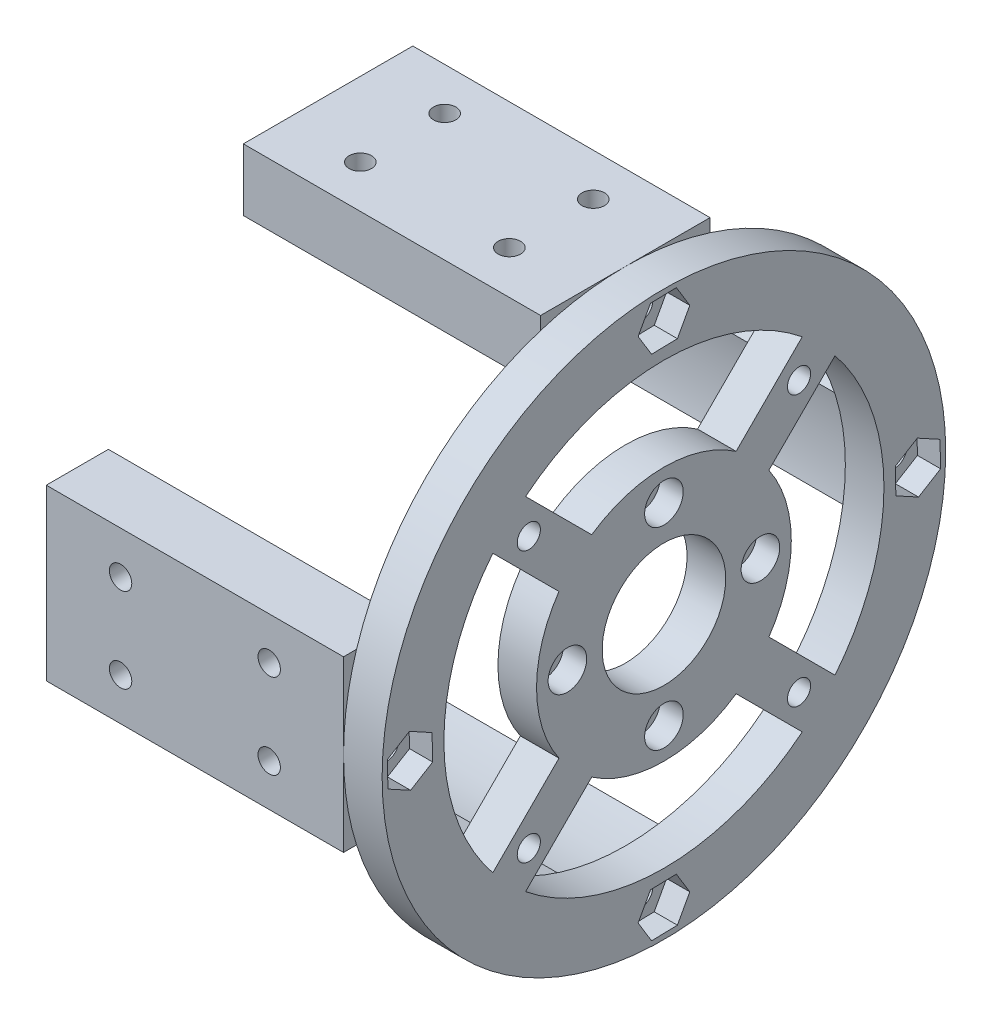
from build123d import *

# Parameters (mm, degrees)
SKETCH_1_R               = 36.5
SKETCH_1_R_2             = 1.55
SKETCH_1_R_3             = 8
EXTRUDE_1_DEPTH          = 5
CUT_EXTRUDE_2_REACH      = 53.86
SKETCH_5_R               = 1.55
CUT_EXTRUDE_3_REACH      = 53.86
SKETCH_7_R               = 1.55
CUT_EXTRUDE_4_DEPTH      = 3
SKETCH_9_R               = 1.55
EXTRUDE_4_DEPTH          = 38.5
SKETCH_10_R              = 1.5
CUT_EXTRUDE_5_DEPTH      = 5
PATTERN_CIRCULAR_1_COUNT = 4
SKETCH_16_R              = 1.45
CUT_EXTRUDE_6_DEPTH      = 3
SKETCH_17_R              = 1.45
CUT_EXTRUDE_7_DEPTH      = 3
SKETCH_18_R              = 2.5
CUT_EXTRUDE_8_DEPTH      = 3


with BuildPart() as part:
    # 草图1 → 凸台-拉伸1 (new body)
    with BuildSketch(Plane(origin=(0, 0, 0), x_dir=(0, 0, -1), z_dir=(1, 0, 0))):
        Circle(SKETCH_1_R)
        with Locations((0, 12.5)):
            Circle(SKETCH_1_R_2, mode=Mode.SUBTRACT)
        with Locations((12.5, 0)):
            Circle(SKETCH_1_R_2, mode=Mode.SUBTRACT)
        with Locations((0, -12.5)):
            Circle(SKETCH_1_R_2, mode=Mode.SUBTRACT)
        with Locations((-12.5, 0)):
            Circle(SKETCH_1_R_2, mode=Mode.SUBTRACT)
        Circle(SKETCH_1_R_3, mode=Mode.SUBTRACT)
        with BuildLine():
            Line((13.594114249, 9.351473562), (22.161904167, 17.91926348))
            ThreePointArc((22.161904167, 17.91926348), (28.5, 0), (22.161904167, -17.91926348))
            Line((22.161904167, -17.91926348), (13.594114249, -9.351473562))
            ThreePointArc((13.594114249, -9.351473562), (16.5, 0), (13.594114249, 9.351473562))
        make_face(mode=Mode.SUBTRACT)
        with BuildLine():
            Line((9.351473562, 13.594114249), (17.91926348, 22.161904167))
            ThreePointArc((17.91926348, 22.161904167), (0, 28.5), (-17.91926348, 22.161904167))
            Line((-17.91926348, 22.161904167), (-9.351473562, 13.594114249))
            ThreePointArc((-9.351473562, 13.594114249), (0, 16.5), (9.351473562, 13.594114249))
        make_face(mode=Mode.SUBTRACT)
        with BuildLine():
            Line((9.351473562, -13.594114249), (17.91926348, -22.161904167))
            ThreePointArc((17.91926348, -22.161904167), (0, -28.5), (-17.91926348, -22.161904167))
            Line((-17.91926348, -22.161904167), (-9.351473562, -13.594114249))
            ThreePointArc((-9.351473562, -13.594114249), (0, -16.5), (9.351473562, -13.594114249))
        make_face(mode=Mode.SUBTRACT)
        with BuildLine():
            Line((-13.594114249, -9.351473562), (-22.161904167, -17.91926348))
            ThreePointArc((-22.161904167, -17.91926348), (-28.5, 0), (-22.161904167, 17.91926348))
            Line((-22.161904167, 17.91926348), (-13.594114249, 9.351473562))
            ThreePointArc((-13.594114249, 9.351473562), (-16.5, 0), (-13.594114249, -9.351473562))
        make_face(mode=Mode.SUBTRACT)
    extrude(amount=-EXTRUDE_1_DEPTH)

    # 草图5 → 切除-拉伸2 (cut, up to next)
    with BuildSketch(Plane(origin=(0, 0, 0), x_dir=(0, 0, -1), z_dir=(1, 0, 0)), mode=Mode.PRIVATE) as cut_extrude_2_sk1:
        with Locations((-0.006483679, -32.906479867)):
            Circle(SKETCH_5_R)
    cut_extrude_2_tool1 = extrude(cut_extrude_2_sk1.sketch, amount=-CUT_EXTRUDE_2_REACH, mode=Mode.PRIVATE) & part.part
    # 草图5 → 切除-拉伸2 (cut, up to next)
    with BuildSketch(Plane(origin=(0, 0, 0), x_dir=(0, 0, -1), z_dir=(1, 0, 0)), mode=Mode.PRIVATE) as cut_extrude_2_sk2:
        with Locations((-32.9, 0)):
            Circle(SKETCH_5_R)
    cut_extrude_2_tool2 = extrude(cut_extrude_2_sk2.sketch, amount=-CUT_EXTRUDE_2_REACH, mode=Mode.PRIVATE) & part.part
    # 草图5 → 切除-拉伸2 (cut, up to next)
    with BuildSketch(Plane(origin=(0, 0, 0), x_dir=(0, 0, -1), z_dir=(1, 0, 0)), mode=Mode.PRIVATE) as cut_extrude_2_sk3:
        with Locations((0.006479867, 32.893516321)):
            Circle(SKETCH_5_R)
    cut_extrude_2_tool3 = extrude(cut_extrude_2_sk3.sketch, amount=-CUT_EXTRUDE_2_REACH, mode=Mode.PRIVATE) & part.part
    # 草图5 → 切除-拉伸2 (cut, up to next)
    with BuildSketch(Plane(origin=(0, 0, 0), x_dir=(0, 0, -1), z_dir=(1, 0, 0)), mode=Mode.PRIVATE) as cut_extrude_2_sk4:
        with Locations((32.899996188, -0.012963547)):
            Circle(SKETCH_5_R)
    cut_extrude_2_tool4 = extrude(cut_extrude_2_sk4.sketch, amount=-CUT_EXTRUDE_2_REACH, mode=Mode.PRIVATE) & part.part
    add(cut_extrude_2_tool1.solids().sort_by_distance((0, -32.90648, 0.006484))[0], mode=Mode.SUBTRACT)
    add(cut_extrude_2_tool2.solids().sort_by_distance((0, 0, 32.9))[0], mode=Mode.SUBTRACT)
    add(cut_extrude_2_tool3.solids().sort_by_distance((0, 32.893516, -0.00648))[0], mode=Mode.SUBTRACT)
    add(cut_extrude_2_tool4.solids().sort_by_distance((0, -0.012964, -32.899996))[0], mode=Mode.SUBTRACT)

    # 草图7 → 切除-拉伸3 (cut, up to next)
    with BuildSketch(Plane(origin=(0, 0, 0), x_dir=(0, 0, -1), z_dir=(1, 0, 0)), mode=Mode.PRIVATE) as cut_extrude_3_sk1:
        with Locations((9.1971e-05, -32.90647921)):
            Circle(SKETCH_7_R)
    cut_extrude_3_tool1 = extrude(cut_extrude_3_sk1.sketch, amount=-CUT_EXTRUDE_3_REACH, mode=Mode.PRIVATE) & part.part
    add(cut_extrude_3_tool1.solids().sort_by_distance((0, -32.906479, -9.2e-05))[0], mode=Mode.SUBTRACT)

    # 草图8 → 切除-拉伸4 (cut)
    with BuildSketch(Plane(origin=(0, 0, 0), x_dir=(0, 0, -1), z_dir=(1, 0, 0))):
        Polygon((35.836823617, -1.606256173), (35.757341789, 1.738938409), (32.820577385, 3.342702418), (29.963294811, 1.601271844), (30.042776639, -1.743922738), (32.979541042, -3.347686747), align=None)
        Polygon((3.35167445, 32.972998149), (1.610243876, 35.830280724), (-1.734950706, 35.750798895), (-3.338714715, 32.814034492), (-1.597284141, 29.956751917), (1.747910441, 30.036233746), align=None)
        Polygon((-1.59971328, -35.832835914), (1.745481303, -35.753354086), (3.349245312, -32.816589682), (1.607814738, -29.959307107), (-1.737379845, -30.038788936), (-3.341143854, -32.975553339), align=None)
        Polygon((-35.826293021, 1.603700983), (-35.746811192, -1.7414936), (-32.810046789, -3.345257608), (-29.952764214, -1.603827035), (-30.032246042, 1.741367548), (-32.969010446, 3.345131557), align=None)
    extrude(amount=-CUT_EXTRUDE_4_DEPTH, mode=Mode.SUBTRACT)

    # 草图9 → 凸台-拉伸4 (add)
    # profile 1 of 4: a face of its own
    with BuildSketch(Plane.ZY.offset(5)):
        with BuildLine():
            Line((-10.975761682, 36.5), (-10.975761682, 28.456680332))
            ThreePointArc((-10.975761682, 28.456680332), (-5.582170272, 29.984819077), (0, 30.5))
            Line((0, 30.5), (0, 30.518609682))
            ThreePointArc((0, 30.518609682), (4.640042689, 30.151557641), (9.171526885, 29.088366998))
            ThreePointArc((9.171526885, 29.088366998), (10.078594454, 28.78666243), (10.975761682, 28.456680332))
            Line((10.975761682, 28.456680332), (10.975761682, 36.5))
            Line((10.975761682, 36.5), (-10.975761682, 36.5))
        make_face()
        with Locations(Location((-0.006479867, 32.893516321, 0), (0, 0, 180))):
            Circle(SKETCH_9_R, mode=Mode.SUBTRACT)
    # profile 2 of 4: a face of its own
    with BuildSketch(Plane.ZY.offset(5)):
        with BuildLine():
            Line((-29.904013109, 6), (-35.786769786, 7.180327869))
            ThreePointArc((-35.786769786, 7.180327869), (-36.5, 0), (-35.786769786, -7.180327869))
            Line((-35.786769786, -7.180327869), (-29.904013109, -6))
            ThreePointArc((-29.904013109, -6), (-30.5, 0), (-29.904013109, 6))
        make_face()
        with Locations(Location((-32.899996188, -0.012963547, 0), (0, 0, 180))):
            Circle(SKETCH_9_R, mode=Mode.SUBTRACT)
    # profile 3 of 4: a face of its own
    with BuildSketch(Plane.ZY.offset(5)):
        with BuildLine():
            Line((36.5, 10.975761682), (28.456680332, 10.975761682))
            ThreePointArc((28.456680332, 10.975761682), (30.485019718, 0.955810029), (29.088366998, -9.171526885))
            Line((29.088366998, -9.171526885), (34.810668702, -10.975761682))
            Line((34.810668702, -10.975761682), (36.5, -10.975761682))
            Line((36.5, -10.975761682), (36.5, 10.975761682))
        make_face()
        with Locations(Location((32.9, 0, 0), (0, 0, 180))):
            Circle(SKETCH_9_R, mode=Mode.SUBTRACT)
    # profile 4 of 4: a face of its own
    with BuildSketch(Plane.ZY.offset(5)):
        with BuildLine():
            Line((-6, -29.904013109), (-7.180327869, -35.786769786))
            ThreePointArc((-7.180327869, -35.786769786), (0, -36.5), (7.180327869, -35.786769786))
            Line((7.180327869, -35.786769786), (6, -29.904013109))
            ThreePointArc((6, -29.904013109), (0, -30.5), (-6, -29.904013109))
        make_face()
        with BuildLine():
            ThreePointArc((0.003040957, -34.456476044), (-1.550091963, -32.906324313), (0.003350752, -31.356483034))
            ThreePointArc((0.003350752, -31.356483034), (1.556483672, -32.906634765), (0.003040957, -34.456476044))
        make_face(mode=Mode.SUBTRACT)
    extrude(amount=EXTRUDE_4_DEPTH)

    # 草图10 → 切除-拉伸5 (cut)
    with BuildSketch(Plane(origin=(0, 0, 0), x_dir=(0, 0, -1), z_dir=(1, 0, 0))):
        with Locations((-17.5, 17.5)):
            Circle(SKETCH_10_R)
    cut_extrude_5 = extrude(amount=-CUT_EXTRUDE_5_DEPTH, mode=Mode.SUBTRACT)

    # 阵列(圆周)1: 切除-拉伸5 ×4 about axis
    pattern_circular_1_axis = Axis((0, 0, 0), (1, 0, 0))
    for i in range(1, PATTERN_CIRCULAR_1_COUNT):
        add(cut_extrude_5.rotate(pattern_circular_1_axis, i * 360 / PATTERN_CIRCULAR_1_COUNT), mode=Mode.SUBTRACT)

    # 草图16 → 切除-拉伸6 (cut)
    with BuildSketch(Plane.XY.offset(36.5)):
        with Locations((-33.875, 5.475761682)):
            Circle(SKETCH_16_R)
        with Locations((-14.625, 5.475761682)):
            Circle(SKETCH_16_R)
        with Locations((-33.875, -5.493718925)):
            Circle(SKETCH_16_R)
        with Locations((-14.625, -5.529614372)):
            Circle(SKETCH_16_R)
    extrude(amount=-CUT_EXTRUDE_6_DEPTH, mode=Mode.SUBTRACT)

    # 草图17 → 切除-拉伸7 (cut)
    with BuildSketch(Plane(origin=(0, 36.5, 0), x_dir=(1, 0, 0), z_dir=(0, 1, 0))):
        with Locations(Location((-33.875, 5.475761682, 0), (0, 0, 270))):
            Circle(SKETCH_17_R)
        with Locations(Location((-14.625, 5.475761682, 0), (0, 0, 270))):
            Circle(SKETCH_17_R)
        with Locations(Location((-33.875, -5.448898044, 0), (0, 0, 270))):
            Circle(SKETCH_17_R)
        with Locations(Location((-14.625, -5.395128045, 0), (0, 0, 270))):
            Circle(SKETCH_17_R)
    extrude(amount=-CUT_EXTRUDE_7_DEPTH, mode=Mode.SUBTRACT)

    # 草图18 → 切除-拉伸8 (cut)
    with BuildSketch(Plane(origin=(0, 0, 0), x_dir=(0, 0, -1), z_dir=(1, 0, 0))):
        with Locations((0, -12.5)):
            Circle(SKETCH_18_R)
        with Locations((12.5, 0)):
            Circle(SKETCH_18_R)
        with Locations((0, 12.5)):
            Circle(SKETCH_18_R)
        with Locations((-12.5, 0)):
            Circle(SKETCH_18_R)
    extrude(amount=-CUT_EXTRUDE_8_DEPTH, mode=Mode.SUBTRACT)


solid = part.part
